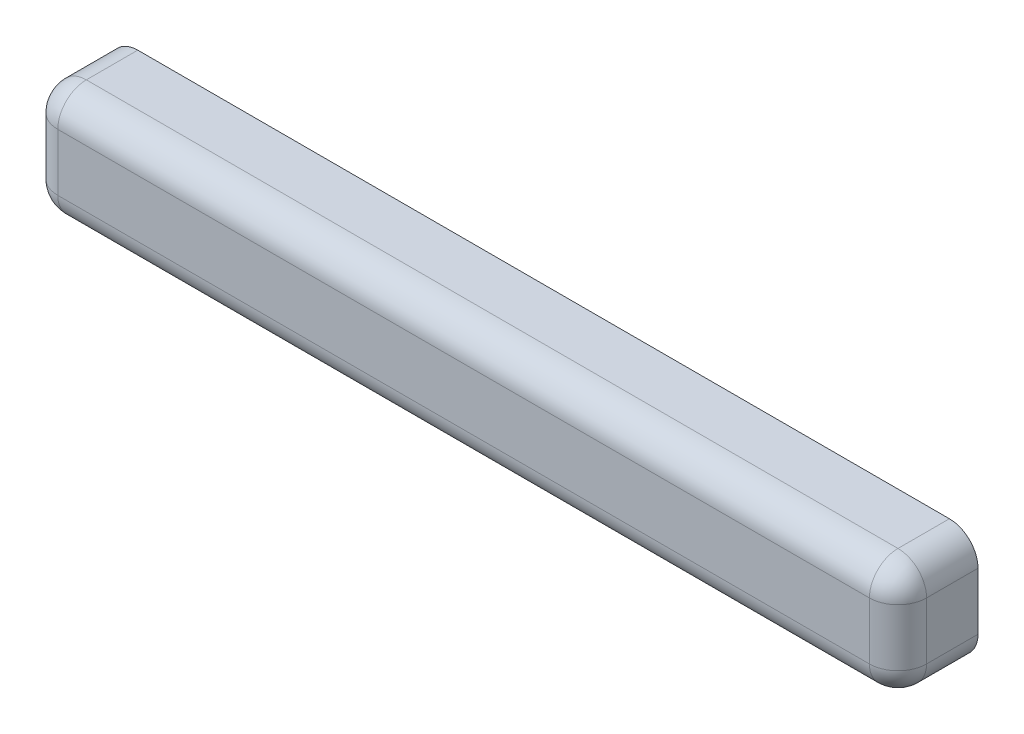
from build123d import *

# Parameters (mm, degrees)
SKETCH1_W           = 965.2
SKETCH1_H           = 127
BOSS_EXTRUDE1_DEPTH = 44.45
FILLET1_R           = 31.75
FILLET2_R           = 31.75
FILLET3_R           = 31.75
SKETCH6_R           = 4.7625
CUT_EXTRUDE1_DEPTH  = 25.4


with BuildPart() as part:
    # Sketch1 → Boss-Extrude1 (new, symmetric)
    with BuildSketch(Plane.XY):
        Rectangle(SKETCH1_W, SKETCH1_H)
    extrude(amount=BOSS_EXTRUDE1_DEPTH, both=True)

    # Fillet1
    fillet1_edges = [part.edges().sort_by_distance(p)[0] for p in [
        (0, -63.5, 44.45),
        (0, 63.5, 44.45),
    ]]
    fillet(fillet1_edges, radius=FILLET1_R)

    # Fillet2
    fillet2_edges = [part.edges().sort_by_distance(p)[0] for p in [
        (-482.6, 0, 44.45),
        (-482.6, -63.5, -15.875),
        (-482.6, 63.5, -15.875),
        (-482.6, 54.200640303, 35.150640303),
        (-482.6, -54.200640303, 35.150640303),
    ]]
    fillet(fillet2_edges, radius=FILLET2_R)

    # Fillet3
    fillet3_edges = [part.edges().sort_by_distance(p)[0] for p in [
        (482.6, 0, 44.45),
        (482.6, 63.5, -15.875),
        (482.6, -63.5, -15.875),
        (482.6, 54.200640303, 35.150640303),
        (482.6, -54.200640303, 35.150640303),
    ]]
    fillet(fillet3_edges, radius=FILLET3_R)

    # Sketch6 → Cut-Extrude1 (cut)
    with BuildSketch(Plane(origin=(0, 0, -44.45), x_dir=(-1, 0, 0), z_dir=(0, 0, -1))):
        with Locations((-11.655611638, 0)):
            Circle(SKETCH6_R)
        with Locations((13.744388362, 0)):
            Circle(SKETCH6_R)
        with Locations((-271.716271796, 0.118953538)):
            Circle(SKETCH6_R)
        with Locations((-246.316271796, 0.118953538)):
            Circle(SKETCH6_R)
        with Locations(Location((246.316271796, 0.118953538, 0), (0, 0, 180))):
            Circle(SKETCH6_R)
        with Locations(Location((271.716271796, 0.118953538, 0), (0, 0, 180))):
            Circle(SKETCH6_R)
    extrude(amount=-CUT_EXTRUDE1_DEPTH, mode=Mode.SUBTRACT)


solid = part.part
